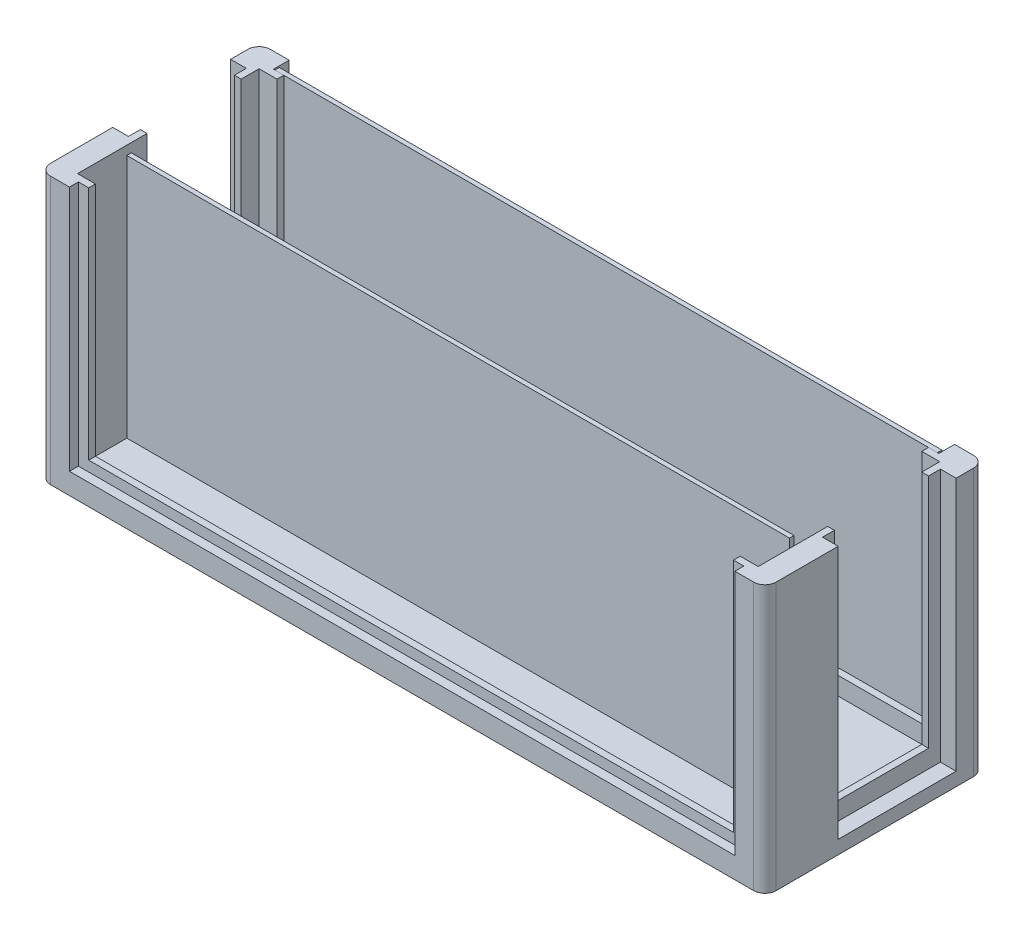
from build123d import *

# Parameters (mm, degrees)
SKETCH1_W            = 157.8
SKETCH1_H            = 59.6
BOSS_EXTRUDE1_DEPTH  = 35
SHELL1_T             = -3
SKETCH2_W            = 143.8
SKETCH2_H            = 50.6
SKETCH2_H_2          = 2
CUT_EXTRUDE1_DEPTH   = 173.273039098
SKETCH2_3_W          = 147.8
SKETCH2_3_H          = 54.6
CUT_EXTRUDE2_DEPTH   = 1.5
SKETCH3_W            = 21
SKETCH3_H            = 52.6
CUT_EXTRUDE3_DEPTH   = 173.273039098
SKETCH3_3_W          = 25
SKETCH3_3_H          = 54.6
CUT_EXTRUDE4_DEPTH   = 1.5
SKETCH4_W            = 147.8
SKETCH4_H            = 54.6
BOSS_EXTRUDE2_DEPTH  = 1
SKETCH5_W            = 25
SKETCH5_H            = 54.6
BOSS_EXTRUDE3_DEPTH  = 1
SKETCH6_W            = 25.3
SKETCH6_H            = 56.6
CUT_EXTRUDE5_DEPTH   = 1.5
SKETCH7_W            = 26.3
SKETCH7_H            = 56.6
CUT_EXTRUDE6_DEPTH   = 1.5
SKETCH8_W            = 26.3
SKETCH8_H            = 56.6
CUT_EXTRUDE7_DEPTH   = 1.5
BOSS_EXTRUDE4_DEPTH  = 2
BOSS_EXTRUDE5_DEPTH  = 2
BOSS_EXTRUDE6_DEPTH  = 2
BOSS_EXTRUDE7_DEPTH  = 2
BOSS_EXTRUDE8_DEPTH  = 10
CUT_EXTRUDE8_START   = -11.5
CUT_EXTRUDE8_DEPTH   = 2.5
BOSS_EXTRUDE10_DEPTH = 1.5
CUT_EXTRUDE9_DEPTH   = 11.5
CUT_EXTRUDE10_START  = -3.5
SKETCH16_W           = 148.4
SKETCH16_H           = 55.2
CUT_EXTRUDE10_DEPTH  = 3.5
SKETCH17_W           = 148.4
SKETCH17_H           = 55.2
CUT_EXTRUDE11_DEPTH  = 2
FILLET1_R            = 2.5


with BuildPart() as part:
    # Sketch1 → Boss-Extrude1 (new body)
    with BuildSketch(Plane.XY):
        with Locations((78.9, 29.8)):
            Rectangle(SKETCH1_W, SKETCH1_H)
    extrude(amount=BOSS_EXTRUDE1_DEPTH)

    # Shell1
    shell1_openings = [part.faces().sort_by_distance(p)[0] for p in [
        (78.9, 59.6, 17.5),
    ]]
    offset(amount=SHELL1_T, openings=shell1_openings, kind=Kind.INTERSECTION)

    # Sketch2 → Cut-Extrude1 (cut, through all)
    with BuildSketch(Plane.XY.offset(35)):
        with Locations((78.9, 32.3)):
            Rectangle(SKETCH2_W, SKETCH2_H)
        with Locations((78.9, 58.6)):
            Rectangle(SKETCH2_W, SKETCH2_H_2)
    extrude(amount=-CUT_EXTRUDE1_DEPTH, mode=Mode.SUBTRACT)

    # Sketch2<3> → Cut-Extrude2 (cut)
    with BuildSketch(Plane.XY.offset(35)):
        with Locations((78.9, 32.3)):
            Rectangle(SKETCH2_3_W, SKETCH2_3_H)
    cut_extrude2 = extrude(amount=-CUT_EXTRUDE2_DEPTH, mode=Mode.SUBTRACT)

    # Mirror1: Cut-Extrude2 across plane
    add(cut_extrude2.mirror(Plane.XY.offset(17.5)), mode=Mode.SUBTRACT)

    # Sketch3 → Cut-Extrude3 (cut, through all)
    with BuildSketch(Plane(origin=(157.8, 0, 0), x_dir=(0, 0, -1), z_dir=(1, 0, 0))):
        with Locations((-17.5, 33.3)):
            Rectangle(SKETCH3_W, SKETCH3_H)
    extrude(amount=-CUT_EXTRUDE3_DEPTH, mode=Mode.SUBTRACT)

    # Sketch3<3> → Cut-Extrude4 (cut)
    with BuildSketch(Plane(origin=(157.8, 0, 0), x_dir=(0, 0, -1), z_dir=(1, 0, 0))):
        with Locations((-17.5, 32.3)):
            Rectangle(SKETCH3_3_W, SKETCH3_3_H)
    cut_extrude4 = extrude(amount=-CUT_EXTRUDE4_DEPTH, mode=Mode.SUBTRACT)

    # Mirror2: Cut-Extrude4 across plane
    add(cut_extrude4.mirror(Plane(origin=(78.9, 0, 0), x_dir=(0, 0, 1), z_dir=(1, 0, 0))), mode=Mode.SUBTRACT)

    # Sketch6 → Cut-Extrude5 (cut)
    with BuildSketch(Plane(origin=(157.8, 0, 0), x_dir=(0, 0, -1), z_dir=(1, 0, 0))):
        with Locations((-17.5, 31.3)):
            Rectangle(SKETCH6_W, SKETCH6_H)
    cut_extrude5 = extrude(amount=-CUT_EXTRUDE5_DEPTH, mode=Mode.SUBTRACT)

    # Mirror5: Cut-Extrude5 across plane
    add(cut_extrude5.mirror(Plane(origin=(78.9, 0, 0), x_dir=(0, 0, 1), z_dir=(1, 0, 0))), mode=Mode.SUBTRACT)

    # Sketch7 → Cut-Extrude6 (cut)
    with BuildSketch(Plane(origin=(157.8, 0, 0), x_dir=(0, 0, -1), z_dir=(1, 0, 0))):
        with Locations((-17.5, 31.3)):
            Rectangle(SKETCH7_W, SKETCH7_H)
    extrude(amount=-CUT_EXTRUDE6_DEPTH, mode=Mode.SUBTRACT)

    # Sketch8 → Cut-Extrude7 (cut)
    with BuildSketch(Plane.ZY):
        with Locations((17.5, 31.3)):
            Rectangle(SKETCH8_W, SKETCH8_H)
    extrude(amount=-CUT_EXTRUDE7_DEPTH, mode=Mode.SUBTRACT)

    # Sketch9 → Boss-Extrude4 (add)
    with BuildSketch(Plane(origin=(0, 0, 0), x_dir=(-1, 0, 0), z_dir=(0, 0, -1))):
        Polygon((0, 59.6), (-5, 59.6), (-5, 5), (-152.8, 5), (-152.8, 59.6), (-157.8, 59.6), (-157.8, 0), (0, 0), align=None)
    extrude(amount=BOSS_EXTRUDE4_DEPTH)

    # Sketch10 → Boss-Extrude5 (add)
    with BuildSketch(Plane.XY.offset(35)):
        Polygon((152.8, 5), (5, 5), (5, 59.6), (0, 59.6), (0, 0), (157.8, 0), (157.8, 59.6), (152.8, 59.6), align=None)
    extrude(amount=BOSS_EXTRUDE5_DEPTH)

    # Sketch11 → Boss-Extrude6 (add)
    with BuildSketch(Plane.ZY):
        Polygon((30.65, 59.6), (30.65, 3), (4.35, 3), (4.35, 59.6), (-2, 59.6), (-2, 0), (37, 0), (37, 59.6), align=None)
    extrude(amount=BOSS_EXTRUDE6_DEPTH)

    # Sketch12 → Boss-Extrude7 (add)
    with BuildSketch(Plane(origin=(157.8, 0, 0), x_dir=(0, 0, -1), z_dir=(1, 0, 0))):
        Polygon((2, 59.6), (-4.35, 59.6), (-4.35, 3), (-30.65, 3), (-30.65, 59.6), (-37, 59.6), (-37, 0), (2, 0), align=None)
    extrude(amount=BOSS_EXTRUDE7_DEPTH)

    # Sketch13 → Boss-Extrude8 (add)
    with BuildSketch(Plane.XY.offset(37)):
        Polygon((152.8, 59.6), (152.8, 5), (5, 5), (5, 59.6), (-2, 59.6), (-2, 0), (159.8, 0), (159.8, 59.6), align=None)
    extrude(amount=BOSS_EXTRUDE8_DEPTH)

    # Sketch14 → Cut-Extrude8 (cut)
    with BuildSketch(Plane.XY.offset(43.5).offset(CUT_EXTRUDE8_START)):
        Polygon((150.8, 7), (7, 7), (7, 59.6), (5, 59.6), (5, 5), (152.8, 5), (152.8, 59.6), (150.8, 59.6), align=None)
    extrude(amount=CUT_EXTRUDE8_DEPTH, mode=Mode.SUBTRACT)

    # Sketch14<2> → Boss-Extrude10 (add)
    with BuildSketch(Plane.XY.offset(43.5)):
        Polygon((150.8, 7), (7, 7), (7, 59.6), (5, 59.6), (5, 5), (152.8, 5), (152.8, 59.6), (150.8, 59.6), align=None)
    extrude(amount=BOSS_EXTRUDE10_DEPTH)

    # Sketch15 → Cut-Extrude9 (cut)
    with BuildSketch(Plane(origin=(0, 0, 32), x_dir=(-1, 0, 0), z_dir=(0, 0, -1))):
        Polygon((-152.8, 5), (-152.8, 59.6), (-154.8, 59.6), (-154.8, 3), (-3, 3), (-3, 59.6), (-5, 59.6), (-5, 5), align=None)
    extrude(amount=-CUT_EXTRUDE9_DEPTH, mode=Mode.SUBTRACT)

    # Sketch16 → Cut-Extrude10 (cut)
    with BuildSketch(Plane(origin=(0, 0, -2), x_dir=(-1, 0, 0), z_dir=(0, 0, -1)).offset(CUT_EXTRUDE10_START)):
        with Locations((-78.9, 32.3)):
            Rectangle(SKETCH16_W, SKETCH16_H)
    extrude(amount=CUT_EXTRUDE10_DEPTH, mode=Mode.SUBTRACT)

    # Sketch17 → Cut-Extrude11 (cut)
    with BuildSketch(Plane.XY.offset(47)):
        with Locations((78.9, 32.3)):
            Rectangle(SKETCH17_W, SKETCH17_H)
    extrude(amount=-CUT_EXTRUDE11_DEPTH, mode=Mode.SUBTRACT)

    # Fillet1
    fillet1_edges = [part.edges().sort_by_distance(p)[0] for p in [
        (-2, 29.8, -2),
        (159.8, 29.8, -2),
        (-2, 29.8, 47),
        (159.8, 29.8, 47),
    ]]
    fillet(fillet1_edges, radius=FILLET1_R)


with BuildPart() as body_2:
    # Sketch4 → Boss-Extrude2 (new body)
    with BuildSketch(Plane.XY.offset(33.5)):
        with Locations((78.9, 32.3)):
            Rectangle(SKETCH4_W, SKETCH4_H)
    extrude(amount=BOSS_EXTRUDE2_DEPTH)


with BuildPart() as body_3:
    # Mirror3: mirrored copy
    add(body_2.part.mirror(Plane.XY.offset(17.5)))


with BuildPart() as body_4:
    # Sketch5 → Boss-Extrude3 (new body)
    with BuildSketch(Plane(origin=(156.3, 0, 0), x_dir=(0, 0, -1), z_dir=(1, 0, 0))):
        with Locations((-17.5, 32.3)):
            Rectangle(SKETCH5_W, SKETCH5_H)
    extrude(amount=BOSS_EXTRUDE3_DEPTH)


with BuildPart() as body_5:
    # Mirror4: mirrored copy
    add(body_4.part.mirror(Plane(origin=(78.9, 0, 0), x_dir=(0, 0, 1), z_dir=(1, 0, 0))))


solid = Compound([part.part, body_2.part, body_3.part])
